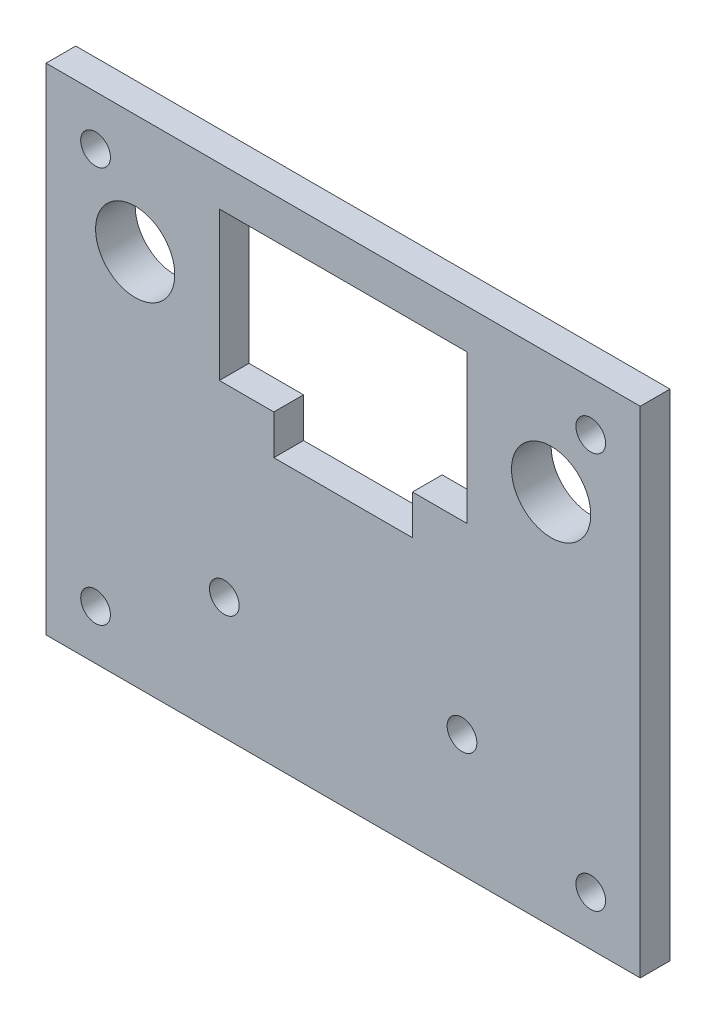
from build123d import *

# Parameters (mm, degrees)
SKETCH1_W           = 60
SKETCH1_H           = 50
BOSS_EXTRUDE1_DEPTH = 3
SKETCH2_R           = 4
CUT_EXTRUDE1_DEPTH  = 40.166312055
BOSS_EXTRUDE2_START = 1
SKETCH3_R           = 5
SKETCH3_R_2         = 4
BOSS_EXTRUDE2_DEPTH = 1
SKETCH4_W           = 25
SKETCH4_H           = 15
CUT_EXTRUDE2_DEPTH  = 40.166312055
SKETCH5_W           = 14
SKETCH5_H           = 4
CUT_EXTRUDE3_DEPTH  = 40.166312055
SKETCH6_W           = 14.423290477
SKETCH6_H           = 22.713380778
BOSS_EXTRUDE3_DEPTH = 3.3
SKETCH8_R           = 1.5
CUT_EXTRUDE4_DEPTH  = 40.190432506
SKETCH9_R           = 1.5
CUT_EXTRUDE5_DEPTH  = 10


with BuildPart() as part:
    # Sketch1 → Boss-Extrude1 (new body)
    with BuildSketch(Plane.XY):
        Rectangle(SKETCH1_W, SKETCH1_H)
    extrude(amount=BOSS_EXTRUDE1_DEPTH)

    # Sketch2 → Cut-Extrude1 (cut, through all)
    with BuildSketch(Plane(origin=(0, 0, 0), x_dir=(-1, 0, 0), z_dir=(0, 0, -1))):
        with Locations((21, 13)):
            Circle(SKETCH2_R)
        with Locations(Location((-21, 13, 0), (0, 0, 180))):
            Circle(SKETCH2_R)
    extrude(amount=-CUT_EXTRUDE1_DEPTH, mode=Mode.SUBTRACT)

    # Sketch3 → Boss-Extrude2 (add)
    # profile 1 of 2: a face of its own
    with BuildSketch(Plane(origin=(0, 0, 0), x_dir=(-1, 0, 0), z_dir=(0, 0, -1)).offset(BOSS_EXTRUDE2_START)):
        with Locations((21, 13)):
            Circle(SKETCH3_R)
        with Locations((21, 13)):
            Circle(SKETCH3_R_2, mode=Mode.SUBTRACT)
    # profile 2 of 2: a face of its own
    with BuildSketch(Plane(origin=(0, 0, 0), x_dir=(-1, 0, 0), z_dir=(0, 0, -1)).offset(BOSS_EXTRUDE2_START)):
        with Locations((-21, 13)):
            Circle(SKETCH3_R)
        with Locations((-21, 13)):
            Circle(SKETCH3_R_2, mode=Mode.SUBTRACT)
    extrude(amount=-BOSS_EXTRUDE2_DEPTH)

    # Sketch4 → Cut-Extrude2 (cut, through all)
    with BuildSketch(Plane(origin=(0, 0, 0), x_dir=(-1, 0, 0), z_dir=(0, 0, -1))):
        with Locations((0, 13.5)):
            Rectangle(SKETCH4_W, SKETCH4_H)
    extrude(amount=-CUT_EXTRUDE2_DEPTH, mode=Mode.SUBTRACT)

    # Sketch5 → Cut-Extrude3 (cut, through all)
    with BuildSketch(Plane(origin=(0, 0, 0), x_dir=(-1, 0, 0), z_dir=(0, 0, -1))):
        with Locations((0, 4)):
            Rectangle(SKETCH5_W, SKETCH5_H)
    extrude(amount=-CUT_EXTRUDE3_DEPTH, mode=Mode.SUBTRACT)

    # Sketch6 → Boss-Extrude3 (add)
    with BuildSketch(Plane(origin=(0, 0, 0), x_dir=(-1, 0, 0), z_dir=(0, 0, -1))):
        with Locations((0.211072543, -13.643309611)):
            Rectangle(SKETCH6_W, SKETCH6_H)
    extrude(amount=BOSS_EXTRUDE3_DEPTH)

    # Sketch8 → Cut-Extrude4 (cut, through all)
    with BuildSketch(Plane(origin=(0, 0, 0), x_dir=(-1, 0, 0), z_dir=(0, 0, -1))):
        with Locations((-25, 20)):
            Circle(SKETCH8_R)
        with Locations(Location((-25, -20, 0), (0, 0, 180))):
            Circle(SKETCH8_R)
        with Locations((25, -20)):
            Circle(SKETCH8_R)
        with Locations(Location((25, 20, 0), (0, 0, 180))):
            Circle(SKETCH8_R)
    extrude(amount=-CUT_EXTRUDE4_DEPTH, mode=Mode.SUBTRACT)

    # Sketch9 → Cut-Extrude5 (cut)
    with BuildSketch(Plane(origin=(0, 0, 0), x_dir=(-1, 0, 0), z_dir=(0, 0, -1))):
        with Locations((-12.000572695, -12.699531371)):
            Circle(SKETCH9_R)
        with Locations((12.000572695, -12.699531371)):
            Circle(SKETCH9_R)
    extrude(amount=-CUT_EXTRUDE5_DEPTH, mode=Mode.SUBTRACT)


solid = part.part
